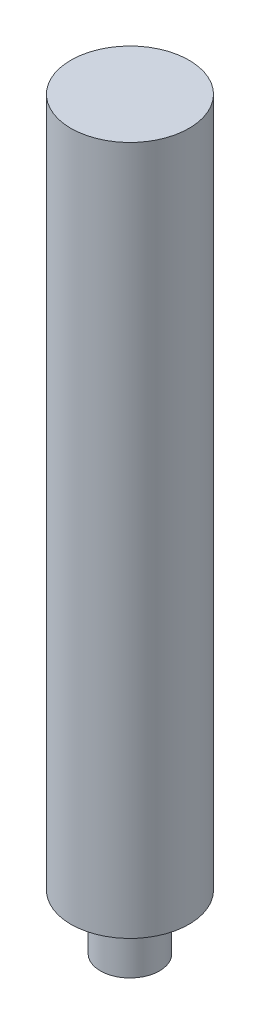
from build123d import *

# Parameters (mm, degrees)
SKETCH_1_R      = 1.5
EXTRUDE_1_DEPTH = 2.8
SKETCH_2_R      = 3
EXTRUDE_2_DEPTH = 35


with BuildPart() as part:
    # 草圖1 → 填料-伸長1 (new body)
    with BuildSketch(Plane(origin=(0, 0, 0), x_dir=(1, 0, 0), z_dir=(0, 1, 0))):
        with Locations(Location((0, 0, 0), (0, 0, 270))):
            Circle(SKETCH_1_R)
    extrude(amount=EXTRUDE_1_DEPTH)

    # 草圖2 → 填料-伸長2 (add)
    with BuildSketch(Plane(origin=(0, 2.8, 0), x_dir=(1, 0, 0), z_dir=(0, 1, 0))):
        with Locations(Location((0, 0, 0), (0, 0, 270))):
            Circle(SKETCH_2_R)
    extrude(amount=EXTRUDE_2_DEPTH)


solid = part.part
